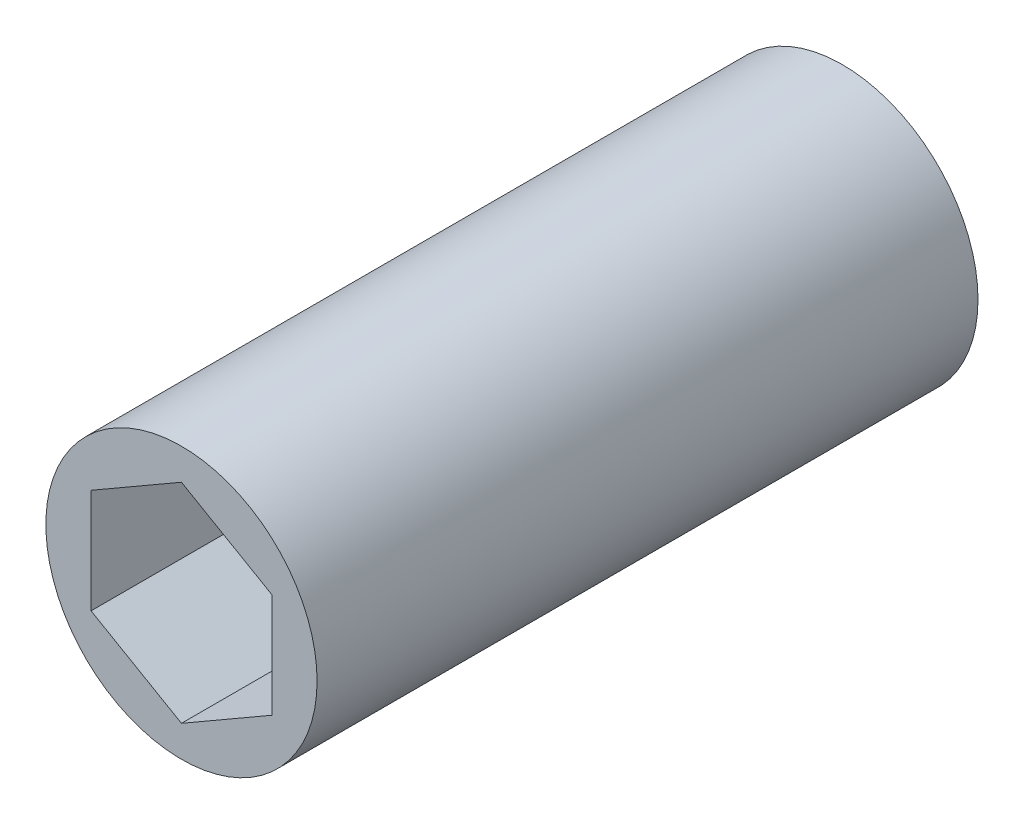
from build123d import *

# Parameters (mm, degrees)
SKETCH1_R           = 9.525
BOSS_EXTRUDE1_DEPTH = 23.20925


with BuildPart() as part:
    # Sketch1 → Boss-Extrude1 (new, symmetric)
    with BuildSketch(Plane.XY):
        Circle(SKETCH1_R)
        Polygon((0, 7.332348419), (-6.35, 3.666174209), (-6.35, -3.666174209), (0, -7.332348419), (6.35, -3.666174209), (6.35, 3.666174209), align=None, mode=Mode.SUBTRACT)
    extrude(amount=BOSS_EXTRUDE1_DEPTH, both=True)


solid = part.part
